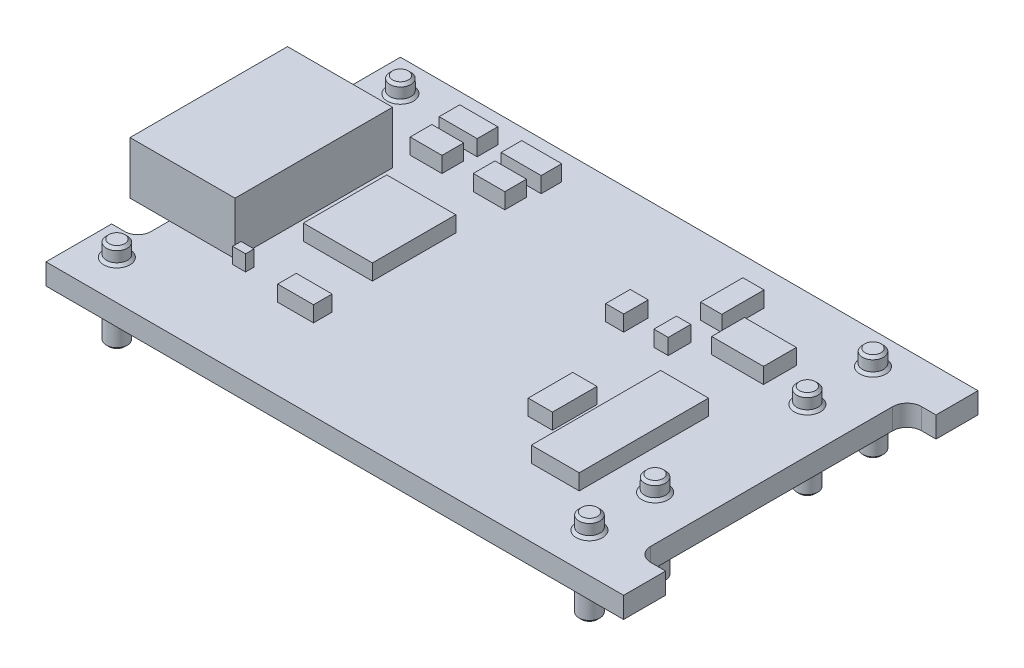
from build123d import *

# Parameters (mm, degrees)
SKETCH1_W                = 27.94
SKETCH1_H                = 17.145
BOSS_EXTRUDE1_DEPTH      = 1.016
CUT_EXTRUDE1_DEPTH       = 1.016
BOSS_EXTRUDE2_DEPTH      = 0.762
BOSS_EXTRUDE2_DEPTH_BACK = 3.556
SKETCH3_R                = 0.508
CHAMFER1_SIZE            = 0.127
SKETCH4_W                = 1.840091878
SKETCH4_H                = 0.995012645
SKETCH4_W_2              = 1.93550405
SKETCH4_W_3              = 1.540225054
SKETCH4_H_2              = 1.049533886
SKETCH4_W_4              = 1.526594744
SKETCH4_W_5              = 2.507977079
SKETCH4_H_3              = 1.58793114
SKETCH4_W_6              = 1.022273265
SKETCH4_H_4              = 2.044546532
SKETCH4_W_7              = 0.69514582
SKETCH4_H_5              = 1.090424817
SKETCH4_W_8              = 2.317152736
SKETCH4_H_6              = 6.256312386
SKETCH4_W_9              = 1.172206678
SKETCH4_H_7              = 2.153589013
SKETCH4_W_10             = 3.339426002
SKETCH4_H_8              = 4.034571822
SKETCH4_W_11             = 0.626994269
SKETCH4_H_9              = 0.408909306
SKETCH4_W_12             = 1.731049397
SKETCH4_H_10             = 0.899600474
SKETCH4_W_13             = 0.872339854
SKETCH4_H_11             = 1.185836988
BOSS_EXTRUDE4_DEPTH      = 0.762
BOSS_EXTRUDE5_DEPTH      = 2.54


with BuildPart() as part:
    # Sketch1 → Boss-Extrude1 (new body)
    with BuildSketch(Plane(origin=(0, 0, 0), x_dir=(1, 0, 0), z_dir=(0, 1, 0))):
        with Locations((13.97, 8.5725)):
            Rectangle(SKETCH1_W, SKETCH1_H)
    extrude(amount=BOSS_EXTRUDE1_DEPTH)

    # Sketch2 → Cut-Extrude1 (cut)
    with BuildSketch(Plane(origin=(0, 1.016, 0), x_dir=(1, 0, 0), z_dir=(0, 1, 0))):
        with BuildLine():
            Line((0.635, 3.175), (0, 3.175))
            Line((0, 3.175), (0, 3.302))
            Line((0, 3.302), (0, 13.843))
            Line((0, 13.843), (0.650095852, 13.843))
            ThreePointArc((0.650095852, 13.843), (1.094049376, 13.647878234), (1.27, 13.195983763))
            Line((1.27, 13.195983763), (1.27, 3.792909702))
            ThreePointArc((1.27, 3.792909702), (1.080473289, 3.352442045), (0.635, 3.175))
        make_face()
        with BuildLine():
            Line((27.2415, 2.032), (27.94, 2.032))
            Line((27.94, 2.032), (27.94, 15.113))
            Line((27.94, 15.113), (27.2415, 15.113))
            ThreePointArc((27.2415, 15.113), (26.747585913, 14.908414087), (26.543, 14.4145))
            Line((26.543, 14.4145), (26.543, 2.693369934))
            ThreePointArc((26.543, 2.693369934), (26.755275802, 2.21802088), (27.2415, 2.032))
        make_face()
    extrude(amount=-CUT_EXTRUDE1_DEPTH, mode=Mode.SUBTRACT)

    # Sketch3 → Boss-Extrude2 (add, two sides: drawn at the far end of the back side and taken through both)
    with BuildSketch(Plane(origin=(0, 1.016, 0), x_dir=(1, 0, 0), z_dir=(0, 1, 0)).offset(-BOSS_EXTRUDE2_DEPTH_BACK)):
        with Locations(Location((24.384, 15.621, 0), (0, 0, 90))):
            Circle(SKETCH3_R)
        with Locations(Location((24.384, 12.446, 0), (0, 0, 90))):
            Circle(SKETCH3_R)
        with Locations(Location((24.384, 1.905, 0), (0, 0, 90))):
            Circle(SKETCH3_R)
        with Locations(Location((24.384, 5.08, 0), (0, 0, 90))):
            Circle(SKETCH3_R)
        with Locations(Location((1.524, 15.621, 0), (0, 0, 90))):
            Circle(SKETCH3_R)
        with Locations(Location((1.524, 1.905, 0), (0, 0, 90))):
            Circle(SKETCH3_R)
    extrude(amount=BOSS_EXTRUDE2_DEPTH + BOSS_EXTRUDE2_DEPTH_BACK)

    # Chamfer1
    chamfer1_edges = [part.edges().sort_by_distance(p)[0] for p in [
        (1.524, 1.016, -15.113),
        (1.524, 0, -15.113),
        (1.524, -2.54, -15.113),
        (1.524, 1.778, -15.113),
        (1.524, 1.016, -1.397),
        (1.524, 0, -1.397),
        (1.524, -2.54, -1.397),
        (1.524, 1.778, -1.397),
        (24.384, 1.016, -4.572),
        (24.384, 0, -4.572),
        (24.384, -2.54, -4.572),
        (24.384, 1.778, -4.572),
        (24.384, 1.016, -11.938),
        (24.384, 0, -11.938),
        (24.384, -2.54, -11.938),
        (24.384, 1.778, -11.938),
        (24.384, 1.016, -1.397),
        (24.384, 0, -1.397),
        (24.384, -2.54, -1.397),
        (24.384, 1.778, -1.397),
        (24.384, 1.016, -15.113),
        (24.384, 0, -15.113),
        (24.384, -2.54, -15.113),
        (24.384, 1.778, -15.113),
    ]]
    chamfer(chamfer1_edges, length=CHAMFER1_SIZE)

    # Sketch4 → Boss-Extrude4 (add)
    with BuildSketch(Plane(origin=(0, 1.016, 0), x_dir=(1, 0, 0), z_dir=(0, 1, 0))):
        with Locations((5.110298363, 15.32631871)):
            Rectangle(SKETCH4_W, SKETCH4_H)
        with Locations((8.156672695, 15.32631871)):
            Rectangle(SKETCH4_W_2, SKETCH4_H)
        with Locations((5.110298363, 13.799723966)):
            Rectangle(SKETCH4_W_3, SKETCH4_H_2)
        with Locations((8.156672695, 13.799723966)):
            Rectangle(SKETCH4_W_4, SKETCH4_H_2)
        with Locations((21.241770498, 13.005758396)):
            Rectangle(SKETCH4_W_5, SKETCH4_H_3)
        with Locations((18.795129815, 14.40627277)):
            Rectangle(SKETCH4_W_6, SKETCH4_H_4)
        with Locations((18.631566092, 11.666580418)):
            Rectangle(SKETCH4_W_7, SKETCH4_H_5)
        with Locations((21.337182669, 6.425726142)):
            Rectangle(SKETCH4_W_8, SKETCH4_H_6)
        with Locations((18.720163108, 6.268977575)):
            Rectangle(SKETCH4_W_9, SKETCH4_H_7)
        with Locations((7.032172103, 9.104082098)):
            Rectangle(SKETCH4_W_10, SKETCH4_H_8)
        with Locations((4.939919486, 4.606079729)):
            Rectangle(SKETCH4_W_11, SKETCH4_H_9)
        with Locations((8.163487851, 4.360734145)):
            Rectangle(SKETCH4_W_12, SKETCH4_H_10)
        with Locations((16.484792234, 11.618874332)):
            Rectangle(SKETCH4_W_13, SKETCH4_H_11)
    extrude(amount=BOSS_EXTRUDE4_DEPTH)

    # Sketch5 → Boss-Extrude5 (add)
    with BuildSketch(Plane(origin=(0, 1.016, 0), x_dir=(1, 0, 0), z_dir=(0, 1, 0))):
        Polygon((4.445, 12.319), (0, 12.319), (-0.635, 12.319), (-0.635, 4.699), (4.445, 4.699), align=None)
    extrude(amount=BOSS_EXTRUDE5_DEPTH)


solid = part.part
